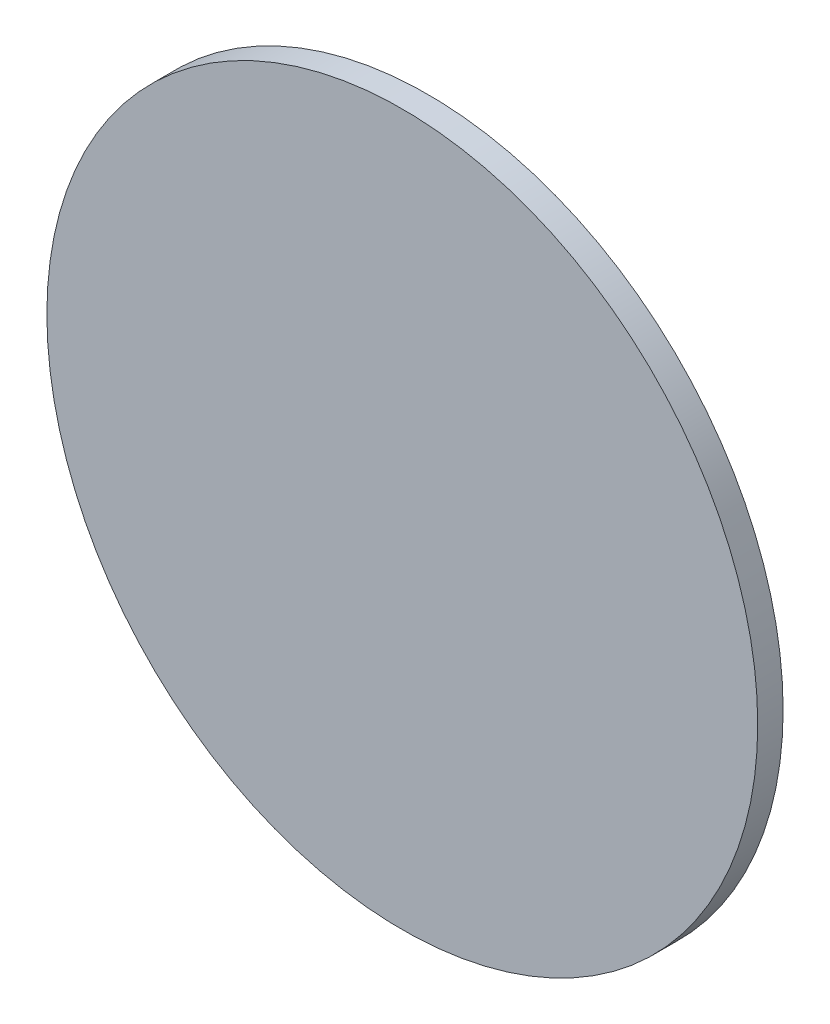
from build123d import *

# Parameters (mm, degrees)
SKETCH1_R           = 140
BOSS_EXTRUDE1_DEPTH = 10
SKETCHTEXT_W        = 5
SKETCHTEXT_H        = 5
SKETCHTEXT_W_2      = 3
SKETCHTEXT_H_2      = 3
CUT_EXTRUDE1_DEPTH  = 0.5


with BuildPart() as part:
    # Sketch1 → Boss-Extrude1 (new body)
    with BuildSketch(Plane.XY):
        Circle(SKETCH1_R)
    extrude(amount=BOSS_EXTRUDE1_DEPTH)

    # SketchText → Cut-Extrude1 (cut)
    # profile 1 of 9: a face of its own
    with BuildSketch(Plane(origin=(0, 0, 0), x_dir=(-1, 0, 0), z_dir=(0, 0, -1))):
        with Locations((-3.733511749, 33.474073248)):
            Rectangle(SKETCHTEXT_W, SKETCHTEXT_H)
        with Locations((-3.733511749, 33.474073248)):
            Rectangle(SKETCHTEXT_W_2, SKETCHTEXT_H_2, mode=Mode.SUBTRACT)
    # profile 2 of 9: a face of its own
    with BuildSketch(Plane(origin=(0, 0, 0), x_dir=(-1, 0, 0), z_dir=(0, 0, -1))):
        Polygon((0.157513892, 34.115098889), (0.157513892, 34.474073248), (1.997257482, 34.474073248), (1.997257482, 34.115098889), (1.234436969, 34.115098889), (1.234436969, 30.974073248), (0.920334405, 30.974073248), (0.920334405, 34.115098889), align=None)
    # profile 3 of 9: a face of its own
    with BuildSketch(Plane(origin=(0, 0, 0), x_dir=(-1, 0, 0), z_dir=(0, 0, -1))):
        with BuildLine():
            Line((4.545134085, 31.781765556), (4.824180559, 31.635231101))
            add(Edge.make_bspline(
                [(4.824180559, 31.635231101), (4.801943964, 31.595787769), (4.758680355, 31.519046667), (4.684279607, 31.413614806), (4.606287535, 31.31876709), (4.521183567, 31.237037436), (4.431513888, 31.165786051), (4.336781233, 31.103448226), (4.236492415, 31.050329706), (4.13064269, 31.005577178), (4.018343139, 30.971167684), (3.899321623, 30.946863463), (3.773350127, 30.931840194), (3.687003948, 30.930095054), (3.642790335, 30.929201453)],
                knots=[0, 0, 0, 0, 1.120438281, 2.179929193, 3.190490725, 4.156257408, 5.095198341, 6.022838206, 6.959905092, 7.901321166, 8.864066838, 9.862729781, 10.905609505, 12, 12, 12, 12], degree=3))
            add(Edge.make_bspline(
                [(3.642790335, 30.929201453), (3.593648357, 30.930348629), (3.497786595, 30.932586435), (3.358246848, 30.9518789), (3.22686743, 30.983351259), (3.103655726, 31.0273168), (2.988913474, 31.084744124), (2.882412619, 31.154703606), (2.783593093, 31.236835861), (2.695568884, 31.331852304), (2.616325001, 31.433534261), (2.546399181, 31.539490146), (2.48794175, 31.64945337), (2.44038914, 31.762723894), (2.401984275, 31.878587788), (2.375217571, 31.998099255), (2.359787823, 32.12093484), (2.357423378, 32.204032175), (2.356231841, 32.245908184)],
                knots=[0, 0, 0, 0, 1.145258523, 2.234067595, 3.276747158, 4.290159414, 5.277019952, 6.260822364, 7.254936242, 8.264827045, 9.274100331, 10.257902744, 11.220704747, 12.172965371, 13.118907548, 14.062713208, 15.023725156, 16, 16, 16, 16], degree=3))
            add(Edge.make_bspline(
                [(2.356231841, 32.245908184), (2.357290982, 32.285203015), (2.359390061, 32.363080179), (2.372620848, 32.478345724), (2.396069141, 32.590374176), (2.428245465, 32.699258624), (2.469796711, 32.804816758), (2.52062893, 32.907112822), (2.580821308, 33.006037962), (2.627293982, 33.068441095), (2.650702995, 33.09987453)],
                knots=[0, 0, 0, 0, 1.024358464, 2.0301432, 3.019427413, 4.004406732, 4.986367066, 5.972626655, 6.978780325, 8, 8, 8, 8], degree=3))
            add(Edge.make_bspline(
                [(2.650702995, 33.09987453), (2.682410678, 33.1377434), (2.744821624, 33.212281551), (2.85037798, 33.310219877), (2.964678176, 33.392263652), (3.086289802, 33.460270788), (3.216626276, 33.511944435), (3.353935567, 33.550452017), (3.499781153, 33.572030028), (3.599486374, 33.575077862), (3.650502674, 33.576637351)],
                knots=[0, 0, 0, 0, 1.030682036, 2.02871468, 2.997146059, 3.962720338, 4.930598197, 5.918074684, 6.934738563, 8, 8, 8, 8], degree=3))
            add(Edge.make_bspline(
                [(3.650502674, 33.576637351), (3.70295028, 33.575283302), (3.805840526, 33.572626967), (3.955872647, 33.548000633), (4.097833363, 33.508948079), (4.231665867, 33.453794288), (4.357383728, 33.382634736), (4.474169778, 33.294492895), (4.58402129, 33.192074808), (4.647929869, 33.113311598), (4.680450591, 33.073231902)],
                knots=[0, 0, 0, 0, 1.056321875, 2.072262726, 3.055038591, 4.01806755, 4.982017516, 5.957941055, 6.960871419, 8, 8, 8, 8], degree=3))
            add(Edge.make_bspline(
                [(4.680450591, 33.073231902), (4.702577529, 33.043028321), (4.746684122, 32.982822202), (4.801931222, 32.884651045), (4.849888617, 32.781940451), (4.888221578, 32.673030153), (4.91926108, 32.559210573), (4.941717898, 32.439668029), (4.954887517, 32.314438117), (4.957476214, 32.229111562), (4.958795943, 32.18561171)],
                knots=[0, 0, 0, 0, 0.94817472, 1.890038105, 2.849395472, 3.817997239, 4.812318967, 5.836947057, 6.897266129, 8, 8, 8, 8], degree=3))
            Line((4.958795943, 32.18561171), (2.670334405, 32.18561171))
            add(Edge.make_bspline(
                [(2.670334405, 32.18561171), (2.671874011, 32.151911245), (2.674901585, 32.085640642), (2.689016729, 31.988669859), (2.711265502, 31.896296516), (2.742534565, 31.809213475), (2.78040141, 31.726283347), (2.826787127, 31.64812131), (2.882126681, 31.57508338), (2.94385238, 31.506516242), (3.012559476, 31.445455481), (3.084842223, 31.390803705), (3.161735788, 31.344998108), (3.242633871, 31.307818219), (3.327405657, 31.278711902), (3.416077852, 31.258844082), (3.508475968, 31.245536975), (3.571461702, 31.24405731), (3.603527514, 31.243304017)],
                knots=[0, 0, 0, 0, 1.094153842, 2.151609401, 3.174256925, 4.172055639, 5.149267565, 6.128595816, 7.11444997, 8.118368179, 9.117203808, 10.09244225, 11.054858984, 12.015122123, 12.976791628, 13.957293641, 14.960065497, 16, 16, 16, 16], degree=3))
            add(Edge.make_bspline(
                [(3.603527514, 31.243304017), (3.634878662, 31.243912074), (3.697085353, 31.245118575), (3.78972621, 31.256850486), (3.880865737, 31.275820762), (3.970126721, 31.301710752), (4.055697566, 31.333287604), (4.134943117, 31.371390462), (4.207823332, 31.413540208), (4.275940299, 31.461749883), (4.342011292, 31.52075807), (4.407553779, 31.594393791), (4.477830432, 31.681481319), (4.521820025, 31.747026985), (4.545134085, 31.781765556)],
                knots=[0, 0, 0, 0, 0.99110716, 1.966546729, 2.947904876, 3.932708344, 4.903319531, 5.828989031, 6.710028674, 7.56322171, 8.463672341, 9.504779593, 10.677557249, 12, 12, 12, 12], degree=3))
        make_face()
        with BuildLine():
            add(Edge.make_bspline(
                [(4.644693379, 32.499714274), (4.633196755, 32.541377148), (4.611069453, 32.621564768), (4.564833089, 32.732605659), (4.512761548, 32.83129356), (4.451139817, 32.916873193), (4.381321091, 32.992876706), (4.300675909, 33.059295291), (4.210240015, 33.118712742), (4.110480874, 33.168865241), (4.004839089, 33.2115551), (3.894232897, 33.240180216), (3.781375109, 33.259789758), (3.705040823, 33.261615867), (3.666628476, 33.262534787)],
                knots=[0, 0, 0, 0, 1.154881502, 2.222775134, 3.210006277, 4.132804581, 5.035138423, 5.962687519, 6.919655026, 7.923214229, 8.944639381, 9.960483929, 10.97369054, 12, 12, 12, 12], degree=3))
            add(Edge.make_bspline(
                [(3.666628476, 33.262534787), (3.635279037, 33.261923115), (3.573307788, 33.260713969), (3.48200672, 33.24924384), (3.394327021, 33.230283995), (3.309621733, 33.204319038), (3.229000865, 33.169710436), (3.150806097, 33.129127209), (3.0770257, 33.079585625), (3.030884405, 33.041826771), (3.007573988, 33.022751133)],
                knots=[0, 0, 0, 0, 1.04873581, 2.073130211, 3.073294108, 4.04793562, 5.032784715, 6.005352987, 6.992311501, 8, 8, 8, 8], degree=3))
            add(Edge.make_bspline(
                [(3.007573988, 33.022751133), (2.990880706, 33.007656817), (2.957097572, 32.977109601), (2.911957051, 32.924480395), (2.868736578, 32.867728832), (2.829402925, 32.804683708), (2.793325339, 32.736062929), (2.759565362, 32.662445294), (2.72917895, 32.583272163), (2.712082839, 32.528099724), (2.703287129, 32.499714274)],
                knots=[0, 0, 0, 0, 0.879870761, 1.780643979, 2.707998968, 3.669668524, 4.684282772, 5.740141944, 6.837334558, 8, 8, 8, 8], degree=3))
            Line((2.703287129, 32.499714274), (4.644693379, 32.499714274))
        make_face(mode=Mode.SUBTRACT)
    # profile 4 of 9: a face of its own
    with BuildSketch(Plane(origin=(0, 0, 0), x_dir=(-1, 0, 0), z_dir=(0, 0, -1))):
        with BuildLine():
            Line((6.798539533, 33.212755139), (6.585398508, 32.993304017))
            add(Edge.make_bspline(
                [(6.585398508, 32.993304017), (6.567008004, 33.014617164), (6.531553278, 33.055706401), (6.475321797, 33.110643467), (6.419298194, 33.156780406), (6.36424938, 33.195732665), (6.308791111, 33.225181812), (6.253574193, 33.246676674), (6.198541454, 33.259978479), (6.161755419, 33.261692918), (6.143691777, 33.262534787)],
                knots=[0, 0, 0, 0, 1.26578478, 2.440284043, 3.530471711, 4.527705817, 5.468200915, 6.346673037, 7.188140097, 8, 8, 8, 8], degree=3))
            add(Edge.make_bspline(
                [(6.143691777, 33.262534787), (6.121552387, 33.261459914), (6.077985201, 33.259344716), (6.015559383, 33.238231285), (5.957608758, 33.205822547), (5.907451778, 33.159853963), (5.864964098, 33.107089695), (5.833950417, 33.04809337), (5.814984433, 32.984645326), (5.812579701, 32.940615468), (5.811360046, 32.918283985)],
                knots=[0, 0, 0, 0, 0.99966794, 1.967205029, 2.953328237, 3.988086729, 5.028030931, 6.008226631, 6.989793394, 8, 8, 8, 8], degree=3))
            add(Edge.make_bspline(
                [(5.811360046, 32.918283985), (5.812470858, 32.898071941), (5.814689351, 32.85770483), (5.831936031, 32.798156797), (5.859402103, 32.740099758), (5.885072297, 32.704536852), (5.898299149, 32.686212671)],
                knots=[0, 0, 0, 0, 0.960159726, 1.917612774, 2.927026955, 4, 4, 4, 4], degree=3))
            add(Edge.make_bspline(
                [(5.898299149, 32.686212671), (5.906262642, 32.676428087), (5.923211935, 32.655602832), (5.95502045, 32.626698979), (5.991042953, 32.594756728), (6.034362891, 32.562819891), (6.083113919, 32.529188166), (6.138353203, 32.495186033), (6.198327708, 32.458221608), (6.241265014, 32.434777172), (6.263583604, 32.422590876)],
                knots=[0, 0, 0, 0, 0.66740084, 1.420478572, 2.27185888, 3.217733974, 4.268547843, 5.408967954, 6.65319498, 8, 8, 8, 8], degree=3))
            add(Edge.make_bspline(
                [(6.263583604, 32.422590876), (6.290797181, 32.407345974), (6.343364851, 32.377897841), (6.418057618, 32.332188138), (6.485844659, 32.286756713), (6.547300327, 32.24208944), (6.601242136, 32.196936572), (6.649306688, 32.153028815), (6.690295132, 32.109039507), (6.713249059, 32.078306393), (6.724220623, 32.063616517)],
                knots=[0, 0, 0, 0, 1.27191281, 2.456916733, 3.569705269, 4.599008579, 5.553216877, 6.436649441, 7.252746552, 8, 8, 8, 8], degree=3))
            add(Edge.make_bspline(
                [(6.724220623, 32.063616517), (6.74243115, 32.033950429), (6.77867348, 31.974909408), (6.816731746, 31.877690981), (6.838792021, 31.774580478), (6.841854241, 31.704048258), (6.843411328, 31.668183825)],
                knots=[0, 0, 0, 0, 0.995354457, 1.980940102, 2.973342416, 4, 4, 4, 4], degree=3))
            add(Edge.make_bspline(
                [(6.843411328, 31.668183825), (6.842691794, 31.642914679), (6.841273874, 31.593119066), (6.831415807, 31.519784236), (6.814460831, 31.449649679), (6.791367077, 31.381954394), (6.760182704, 31.317995454), (6.723634907, 31.256159205), (6.679759995, 31.197783274), (6.62966862, 31.142944314), (6.574823126, 31.092858567), (6.516316987, 31.048834613), (6.454078157, 31.012260276), (6.388551355, 30.981994931), (6.319587701, 30.957926673), (6.247176412, 30.941264141), (6.171547657, 30.93129138), (6.120117849, 30.929906904), (6.093912129, 30.929201453)],
                knots=[0, 0, 0, 0, 1.032770009, 2.035186124, 3.017557409, 3.978232242, 4.952395191, 5.920591857, 6.910227898, 7.931268572, 8.952309245, 9.941945286, 10.918353717, 11.897095711, 12.887975737, 13.898235213, 14.929059601, 16, 16, 16, 16], degree=3))
            add(Edge.make_bspline(
                [(6.093912129, 30.929201453), (6.058544954, 30.930194154), (5.988302027, 30.932165761), (5.884412308, 30.950671822), (5.782891549, 30.979467216), (5.684508009, 31.01918315), (5.591461895, 31.069333863), (5.50633097, 31.129396257), (5.428819508, 31.197386254), (5.384701234, 31.249499165), (5.362642097, 31.27555562)],
                knots=[0, 0, 0, 0, 1.013940152, 2.01379169, 3.017749504, 4.037548394, 5.051665909, 6.043208538, 7.021604269, 8, 8, 8, 8], degree=3))
            Line((5.362642097, 31.27555562), (5.57087527, 31.512534787))
            add(Edge.make_bspline(
                [(5.57087527, 31.512534787), (5.590647683, 31.491180022), (5.628979496, 31.449780582), (5.690280712, 31.394656242), (5.752660114, 31.34845497), (5.8154948, 31.309811556), (5.879714894, 31.280036152), (5.944960509, 31.259117559), (6.011098933, 31.245673366), (6.055521069, 31.244095084), (6.077786328, 31.243304017)],
                knots=[0, 0, 0, 0, 1.179806542, 2.287233372, 3.337373186, 4.324005949, 5.273901747, 6.200048787, 7.097828587, 8, 8, 8, 8], degree=3))
            add(Edge.make_bspline(
                [(6.077786328, 31.243304017), (6.108104254, 31.244674842), (6.167340396, 31.247353204), (6.252184154, 31.271670296), (6.330522781, 31.309800248), (6.398546126, 31.363884946), (6.456448287, 31.426840519), (6.498376462, 31.497754638), (6.524652637, 31.574546095), (6.527738636, 31.627778397), (6.529308764, 31.654862511)],
                knots=[0, 0, 0, 0, 1.072336372, 2.095165389, 3.102688358, 4.141489647, 5.156069229, 6.117746104, 7.042326257, 8, 8, 8, 8], degree=3))
            add(Edge.make_bspline(
                [(6.529308764, 31.654862511), (6.52822247, 31.67717213), (6.526077727, 31.721219485), (6.509234455, 31.784969826), (6.482621603, 31.845439107), (6.456416954, 31.880828754), (6.443070783, 31.898852896)],
                knots=[0, 0, 0, 0, 1.013901739, 2.00181326, 2.98231254, 4, 4, 4, 4], degree=3))
            add(Edge.make_bspline(
                [(6.443070783, 31.898852896), (6.435048389, 31.907888258), (6.417572716, 31.92757054), (6.385517475, 31.955995619), (6.347135613, 31.986633718), (6.30199545, 32.018965307), (6.250005988, 32.052563912), (6.190956513, 32.087253264), (6.12565596, 32.12468099), (6.079485329, 32.149500645), (6.055350431, 32.162474691)],
                knots=[0, 0, 0, 0, 0.615000592, 1.339693406, 2.178160186, 3.116406724, 4.166410947, 5.330106347, 6.604359322, 8, 8, 8, 8], degree=3))
            add(Edge.make_bspline(
                [(6.055350431, 32.162474691), (6.029303791, 32.177013822), (5.978791043, 32.205209838), (5.907243752, 32.249125919), (5.842696398, 32.293793193), (5.783595823, 32.336706033), (5.731434818, 32.380126977), (5.686418869, 32.424104228), (5.646775654, 32.466864214), (5.624828242, 32.497161511), (5.614344822, 32.511633344)],
                knots=[0, 0, 0, 0, 1.262093308, 2.447601706, 3.550203992, 4.582594899, 5.537233252, 6.418365656, 7.244515135, 8, 8, 8, 8], degree=3))
            add(Edge.make_bspline(
                [(5.614344822, 32.511633344), (5.596214222, 32.540778959), (5.559946687, 32.599080375), (5.524731496, 32.696390851), (5.500525467, 32.798835909), (5.498363077, 32.869522763), (5.497257482, 32.905663793)],
                knots=[0, 0, 0, 0, 0.985009483, 1.970363186, 2.962279964, 4, 4, 4, 4], degree=3))
            add(Edge.make_bspline(
                [(5.497257482, 32.905663793), (5.497791677, 32.929289191), (5.498837173, 32.975527442), (5.507181225, 33.043466262), (5.522372936, 33.108014416), (5.541427859, 33.170141279), (5.567910863, 33.228643373), (5.599556768, 33.284300844), (5.636744193, 33.337036762), (5.679587484, 33.386039894), (5.726694129, 33.430549221), (5.777588899, 33.469347849), (5.831127156, 33.502454203), (5.887535575, 33.530219364), (5.947356048, 33.551220747), (6.010170434, 33.565678132), (6.075851589, 33.575333334), (6.120752715, 33.576196419), (6.143691777, 33.576637351)],
                knots=[0, 0, 0, 0, 1.087655834, 2.128696564, 3.144119009, 4.137814668, 5.115653402, 6.093965665, 7.082169637, 8.081268856, 9.086088321, 10.061021666, 11.022561449, 11.980240094, 12.950172527, 13.934149372, 14.944599409, 16, 16, 16, 16], degree=3))
            add(Edge.make_bspline(
                [(6.143691777, 33.576637351), (6.17088384, 33.57553301), (6.225778062, 33.573303612), (6.308132688, 33.555597922), (6.39036603, 33.526464818), (6.47268938, 33.486228584), (6.55449967, 33.434161708), (6.636516526, 33.371232409), (6.719724557, 33.297854695), (6.77168087, 33.241755469), (6.798539533, 33.212755139)],
                knots=[0, 0, 0, 0, 0.845714091, 1.707292901, 2.609013841, 3.555613372, 4.552488639, 5.621697636, 6.770543573, 8, 8, 8, 8], degree=3))
        make_face()
    # profile 5 of 9: a face of its own
    with BuildSketch(Plane(origin=(0, 0, 0), x_dir=(-1, 0, 0), z_dir=(0, 0, -1))):
        Polygon((7.78571902, 34.563816838), (8.099821585, 34.563816838), (8.099821585, 33.531765556), (8.548539533, 33.531765556), (8.548539533, 33.217662992), (8.099821585, 33.217662992), (8.099821585, 30.974073248), (7.78571902, 30.974073248), (7.78571902, 33.217662992), (7.337001072, 33.217662992), (7.337001072, 33.531765556), (7.78571902, 33.531765556), align=None)
    # profile 6 of 9: a face of its own
    with BuildSketch(Plane(origin=(0, 0, 0), x_dir=(-1, 0, 0), z_dir=(0, 0, -1))):
        Polygon((10.119052354, 34.115098889), (10.119052354, 34.474073248), (11.958795943, 34.474073248), (11.958795943, 34.115098889), (11.195975431, 34.115098889), (11.195975431, 30.974073248), (10.881872867, 30.974073248), (10.881872867, 34.115098889), align=None)
    # profile 7 of 9: a face of its own
    with BuildSketch(Plane(origin=(0, 0, 0), x_dir=(-1, 0, 0), z_dir=(0, 0, -1))):
        with BuildLine():
            Line((14.506672546, 31.781765556), (14.78571902, 31.635231101))
            add(Edge.make_bspline(
                [(14.78571902, 31.635231101), (14.763482425, 31.595787769), (14.720218817, 31.519046667), (14.645818069, 31.413614806), (14.567825996, 31.31876709), (14.482722028, 31.237037436), (14.393052349, 31.165786051), (14.298319694, 31.103448226), (14.198030877, 31.050329706), (14.092181152, 31.005577178), (13.979881601, 30.971167684), (13.860860084, 30.946863463), (13.734888589, 30.931840194), (13.648542409, 30.930095054), (13.604328796, 30.929201453)],
                knots=[0, 0, 0, 0, 1.120438281, 2.179929193, 3.190490725, 4.156257408, 5.095198341, 6.022838206, 6.959905092, 7.901321166, 8.864066838, 9.862729781, 10.905609505, 12, 12, 12, 12], degree=3))
            add(Edge.make_bspline(
                [(13.604328796, 30.929201453), (13.555186819, 30.930348629), (13.459325057, 30.932586435), (13.31978531, 30.9518789), (13.188405891, 30.983351259), (13.065194188, 31.0273168), (12.950451935, 31.084744124), (12.843951081, 31.154703606), (12.745131555, 31.236835861), (12.657107346, 31.331852304), (12.577863463, 31.433534261), (12.507937643, 31.539490146), (12.449480212, 31.64945337), (12.401927602, 31.762723894), (12.363522737, 31.878587788), (12.336756033, 31.998099255), (12.321326285, 32.12093484), (12.318961839, 32.204032175), (12.317770302, 32.245908184)],
                knots=[0, 0, 0, 0, 1.145258523, 2.234067595, 3.276747158, 4.290159414, 5.277019952, 6.260822364, 7.254936242, 8.264827045, 9.274100331, 10.257902744, 11.220704747, 12.172965371, 13.118907548, 14.062713208, 15.023725156, 16, 16, 16, 16], degree=3))
            add(Edge.make_bspline(
                [(12.317770302, 32.245908184), (12.318829444, 32.285203015), (12.320928522, 32.363080179), (12.334159309, 32.478345724), (12.357607603, 32.590374176), (12.389783926, 32.699258624), (12.431335173, 32.804816758), (12.482167392, 32.907112822), (12.54235977, 33.006037962), (12.588832443, 33.068441095), (12.612241456, 33.09987453)],
                knots=[0, 0, 0, 0, 1.024358464, 2.0301432, 3.019427413, 4.004406732, 4.986367066, 5.972626655, 6.978780325, 8, 8, 8, 8], degree=3))
            add(Edge.make_bspline(
                [(12.612241456, 33.09987453), (12.643949139, 33.1377434), (12.706360086, 33.212281551), (12.811916441, 33.310219877), (12.926216637, 33.392263652), (13.047828263, 33.460270788), (13.178164738, 33.511944435), (13.315474029, 33.550452017), (13.461319615, 33.572030028), (13.561024836, 33.575077862), (13.612041136, 33.576637351)],
                knots=[0, 0, 0, 0, 1.030682036, 2.02871468, 2.997146059, 3.962720338, 4.930598197, 5.918074684, 6.934738563, 8, 8, 8, 8], degree=3))
            add(Edge.make_bspline(
                [(13.612041136, 33.576637351), (13.664488741, 33.575283302), (13.767378987, 33.572626967), (13.917411108, 33.548000633), (14.059371825, 33.508948079), (14.193204329, 33.453794288), (14.31892219, 33.382634736), (14.435708239, 33.294492895), (14.545559752, 33.192074808), (14.609468331, 33.113311598), (14.641989052, 33.073231902)],
                knots=[0, 0, 0, 0, 1.056321875, 2.072262726, 3.055038591, 4.01806755, 4.982017516, 5.957941055, 6.960871419, 8, 8, 8, 8], degree=3))
            add(Edge.make_bspline(
                [(14.641989052, 33.073231902), (14.664115991, 33.043028321), (14.708222584, 32.982822202), (14.763469684, 32.884651045), (14.811427079, 32.781940451), (14.84976004, 32.673030153), (14.880799541, 32.559210573), (14.90325636, 32.439668029), (14.916425978, 32.314438117), (14.919014676, 32.229111562), (14.920334405, 32.18561171)],
                knots=[0, 0, 0, 0, 0.94817472, 1.890038105, 2.849395472, 3.817997239, 4.812318967, 5.836947057, 6.897266129, 8, 8, 8, 8], degree=3))
            Line((14.920334405, 32.18561171), (12.631872867, 32.18561171))
            add(Edge.make_bspline(
                [(12.631872867, 32.18561171), (12.633412473, 32.151911245), (12.636440047, 32.085640642), (12.65055519, 31.988669859), (12.672803964, 31.896296516), (12.704073027, 31.809213475), (12.741939872, 31.726283347), (12.788325589, 31.64812131), (12.843665143, 31.57508338), (12.905390842, 31.506516242), (12.974097937, 31.445455481), (13.046380684, 31.390803705), (13.123274249, 31.344998108), (13.204172333, 31.307818219), (13.288944118, 31.278711902), (13.377616313, 31.258844082), (13.47001443, 31.245536975), (13.533000164, 31.24405731), (13.565065976, 31.243304017)],
                knots=[0, 0, 0, 0, 1.094153842, 2.151609401, 3.174256925, 4.172055639, 5.149267565, 6.128595816, 7.11444997, 8.118368179, 9.117203808, 10.09244225, 11.054858984, 12.015122123, 12.976791628, 13.957293641, 14.960065497, 16, 16, 16, 16], degree=3))
            add(Edge.make_bspline(
                [(13.565065976, 31.243304017), (13.596417123, 31.243912074), (13.658623814, 31.245118575), (13.751264671, 31.256850486), (13.842404199, 31.275820762), (13.931665182, 31.301710752), (14.017236028, 31.333287604), (14.096481578, 31.371390462), (14.169361794, 31.413540208), (14.23747876, 31.461749883), (14.303549754, 31.52075807), (14.36909224, 31.594393791), (14.439368893, 31.681481319), (14.483358486, 31.747026985), (14.506672546, 31.781765556)],
                knots=[0, 0, 0, 0, 0.99110716, 1.966546729, 2.947904876, 3.932708344, 4.903319531, 5.828989031, 6.710028674, 7.56322171, 8.463672341, 9.504779593, 10.677557249, 12, 12, 12, 12], degree=3))
        make_face()
        with BuildLine():
            add(Edge.make_bspline(
                [(14.606231841, 32.499714274), (14.594735216, 32.541377148), (14.572607915, 32.621564768), (14.52637155, 32.732605659), (14.47430001, 32.83129356), (14.412678278, 32.916873193), (14.342859553, 32.992876706), (14.26221437, 33.059295291), (14.171778477, 33.118712742), (14.072019336, 33.168865241), (13.966377551, 33.2115551), (13.855771359, 33.240180216), (13.742913571, 33.259789758), (13.666579285, 33.261615867), (13.628166937, 33.262534787)],
                knots=[0, 0, 0, 0, 1.154881502, 2.222775134, 3.210006277, 4.132804581, 5.035138423, 5.962687519, 6.919655026, 7.923214229, 8.944639381, 9.960483929, 10.97369054, 12, 12, 12, 12], degree=3))
            add(Edge.make_bspline(
                [(13.628166937, 33.262534787), (13.596817499, 33.261923115), (13.53484625, 33.260713969), (13.443545181, 33.24924384), (13.355865482, 33.230283995), (13.271160195, 33.204319038), (13.190539326, 33.169710436), (13.112344558, 33.129127209), (13.038564162, 33.079585625), (12.992422866, 33.041826771), (12.96911245, 33.022751133)],
                knots=[0, 0, 0, 0, 1.04873581, 2.073130211, 3.073294108, 4.04793562, 5.032784715, 6.005352987, 6.992311501, 8, 8, 8, 8], degree=3))
            add(Edge.make_bspline(
                [(12.96911245, 33.022751133), (12.952419168, 33.007656817), (12.918636034, 32.977109601), (12.873495512, 32.924480395), (12.83027504, 32.867728832), (12.790941387, 32.804683708), (12.7548638, 32.736062929), (12.721103823, 32.662445294), (12.690717411, 32.583272163), (12.673621301, 32.528099724), (12.664825591, 32.499714274)],
                knots=[0, 0, 0, 0, 0.879870761, 1.780643979, 2.707998968, 3.669668524, 4.684282772, 5.740141944, 6.837334558, 8, 8, 8, 8], degree=3))
            Line((12.664825591, 32.499714274), (14.606231841, 32.499714274))
        make_face(mode=Mode.SUBTRACT)
    # profile 8 of 9: a face of its own
    with BuildSketch(Plane(origin=(0, 0, 0), x_dir=(-1, 0, 0), z_dir=(0, 0, -1))):
        Polygon((15.324180559, 33.531765556), (15.697878476, 33.531765556), (16.356231841, 32.609089274), (17.014585206, 33.531765556), (17.388283123, 33.531765556), (16.54343136, 32.347570844), (17.522898508, 30.974073248), (17.149200591, 30.974073248), (16.356231841, 32.085351293), (15.563263091, 30.974073248), (15.189565174, 30.974073248), (16.169733443, 32.347570844), align=None)
    # profile 9 of 9: a face of its own
    with BuildSketch(Plane(origin=(0, 0, 0), x_dir=(-1, 0, 0), z_dir=(0, 0, -1))):
        Polygon((18.195975431, 34.563816838), (18.510077995, 34.563816838), (18.510077995, 33.531765556), (18.958795943, 33.531765556), (18.958795943, 33.217662992), (18.510077995, 33.217662992), (18.510077995, 30.974073248), (18.195975431, 30.974073248), (18.195975431, 33.217662992), (17.747257482, 33.217662992), (17.747257482, 33.531765556), (18.195975431, 33.531765556), align=None)
    extrude(amount=-CUT_EXTRUDE1_DEPTH, mode=Mode.SUBTRACT)


solid = part.part
